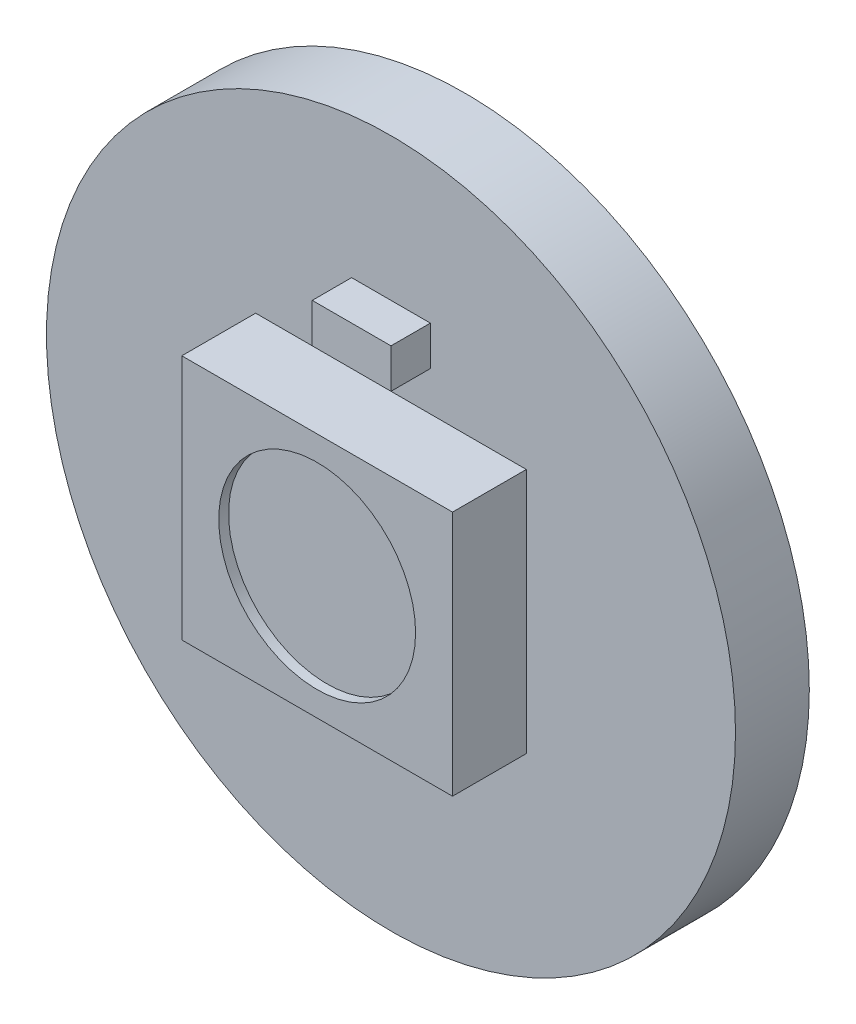
from build123d import *

# Parameters (mm, degrees)
SKETCH1_R           = 7
BOSS_EXTRUDE1_DEPTH = 1.5
SKETCH2_W           = 5.5
SKETCH2_H           = 5
BOSS_EXTRUDE2_DEPTH = 1.5
SKETCH3_R           = 2
CUT_EXTRUDE1_DEPTH  = 0.2
SKETCH4_W           = 1.6
SKETCH4_H           = 0.8
BOSS_EXTRUDE3_DEPTH = 0.8


with BuildPart() as part:
    # Sketch1 → Boss-Extrude1 (new body)
    with BuildSketch(Plane.XY):
        Circle(SKETCH1_R)
    extrude(amount=BOSS_EXTRUDE1_DEPTH)

    # Sketch2 → Boss-Extrude2 (add)
    with BuildSketch(Plane.XY.offset(1.5)):
        Rectangle(SKETCH2_W, SKETCH2_H)
    extrude(amount=BOSS_EXTRUDE2_DEPTH)

    # Sketch3 → Cut-Extrude1 (cut)
    with BuildSketch(Plane.XY.offset(3)):
        Circle(SKETCH3_R)
    extrude(amount=-CUT_EXTRUDE1_DEPTH, mode=Mode.SUBTRACT)

    # Sketch4 → Boss-Extrude3 (add)
    with BuildSketch(Plane.XY.offset(1.5)):
        with Locations((0, 3.7)):
            Rectangle(SKETCH4_W, SKETCH4_H)
    extrude(amount=BOSS_EXTRUDE3_DEPTH)


solid = part.part
